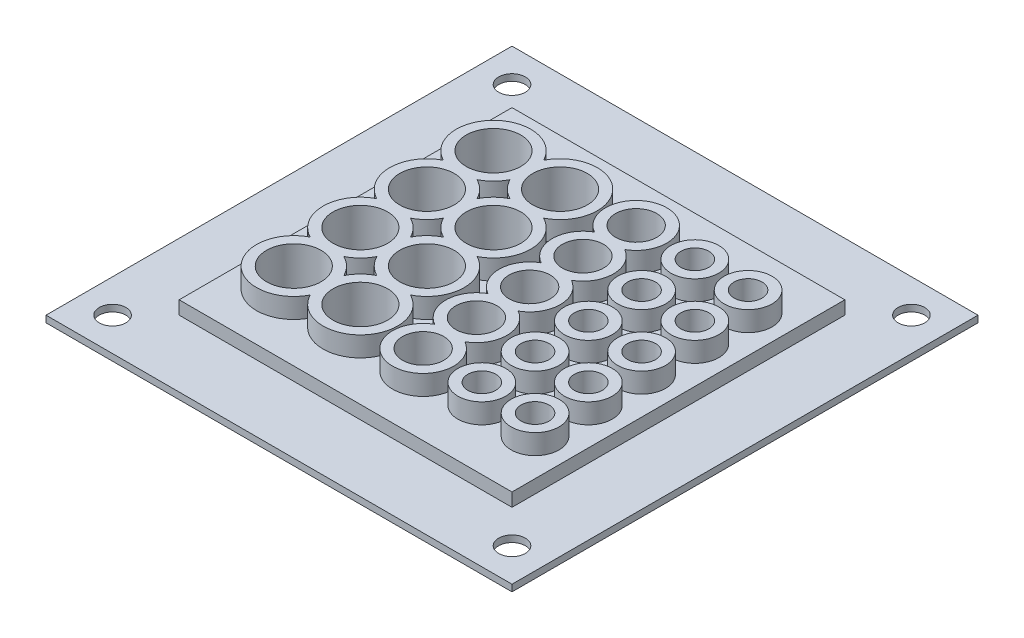
from build123d import *

# Parameters (mm, degrees)
SKETCH1_W           = 50
SKETCH1_H           = 50
SKETCH1_R           = 4.1
SKETCH1_R_2         = 3.1
SKETCH1_R_3         = 2.1
BOSS_EXTRUDE1_DEPTH = 1.5
SKETCH2_R           = 5.6
SKETCH2_R_2         = 4.1
SKETCH2_R_3         = 4.6
SKETCH2_R_4         = 3.1
SKETCH2_R_5         = 3.6
SKETCH2_R_6         = 2.1
EXTRUDE_THIN1_DEPTH = 3
SKETCH3_W           = 70
SKETCH3_H           = 70
SKETCH3_R           = 2
SKETCH3_W_2         = 50
SKETCH3_H_2         = 50
BOSS_EXTRUDE2_DEPTH = 1


with BuildPart() as part:
    # Sketch1 → Boss-Extrude1 (new, symmetric)
    with BuildSketch(Plane(origin=(0, 0, 0), x_dir=(1, 0, 0), z_dir=(0, 1, 0))):
        with Locations((0, 25)):
            Rectangle(SKETCH1_W, SKETCH1_H)
        with Locations(Location((-17.77819266, 10, 0), (0, 0, 270))):
            Circle(SKETCH1_R, mode=Mode.SUBTRACT)
        with Locations(Location((-17.77819266, 20, 0), (0, 0, 270))):
            Circle(SKETCH1_R, mode=Mode.SUBTRACT)
        with Locations(Location((-17.77819266, 30, 0), (0, 0, 270))):
            Circle(SKETCH1_R, mode=Mode.SUBTRACT)
        with Locations(Location((-17.77819266, 40, 0), (0, 0, 270))):
            Circle(SKETCH1_R, mode=Mode.SUBTRACT)
        with Locations(Location((2.654804044, 9, 0), (0, 0, 270))):
            Circle(SKETCH1_R_2, mode=Mode.SUBTRACT)
        with Locations(Location((2.654804044, 17, 0), (0, 0, 270))):
            Circle(SKETCH1_R_2, mode=Mode.SUBTRACT)
        with Locations(Location((2.654804044, 25, 0), (0, 0, 270))):
            Circle(SKETCH1_R_2, mode=Mode.SUBTRACT)
        with Locations(Location((2.654804044, 33, 0), (0, 0, 270))):
            Circle(SKETCH1_R_2, mode=Mode.SUBTRACT)
        with Locations(Location((2.654804044, 41, 0), (0, 0, 270))):
            Circle(SKETCH1_R_2, mode=Mode.SUBTRACT)
        with Locations(Location((11.466739275, 9, 0), (0, 0, 270))):
            Circle(SKETCH1_R_3, mode=Mode.SUBTRACT)
        with Locations(Location((19.466739275, 9, 0), (0, 0, 270))):
            Circle(SKETCH1_R_3, mode=Mode.SUBTRACT)
        with Locations(Location((19.466739275, 17, 0), (0, 0, 270))):
            Circle(SKETCH1_R_3, mode=Mode.SUBTRACT)
        with Locations(Location((19.466739275, 25, 0), (0, 0, 270))):
            Circle(SKETCH1_R_3, mode=Mode.SUBTRACT)
        with Locations(Location((19.466739275, 33, 0), (0, 0, 270))):
            Circle(SKETCH1_R_3, mode=Mode.SUBTRACT)
        with Locations(Location((19.466739275, 41, 0), (0, 0, 270))):
            Circle(SKETCH1_R_3, mode=Mode.SUBTRACT)
        with Locations(Location((11.466739275, 17, 0), (0, 0, 270))):
            Circle(SKETCH1_R_3, mode=Mode.SUBTRACT)
        with Locations(Location((11.466739275, 25, 0), (0, 0, 270))):
            Circle(SKETCH1_R_3, mode=Mode.SUBTRACT)
        with Locations(Location((11.466739275, 33, 0), (0, 0, 270))):
            Circle(SKETCH1_R_3, mode=Mode.SUBTRACT)
        with Locations(Location((11.466739275, 41, 0), (0, 0, 270))):
            Circle(SKETCH1_R_3, mode=Mode.SUBTRACT)
        with Locations(Location((-7.77819266, 10, 0), (0, 0, 270))):
            Circle(SKETCH1_R, mode=Mode.SUBTRACT)
        with Locations(Location((-7.77819266, 20, 0), (0, 0, 270))):
            Circle(SKETCH1_R, mode=Mode.SUBTRACT)
        with Locations(Location((-7.77819266, 30, 0), (0, 0, 270))):
            Circle(SKETCH1_R, mode=Mode.SUBTRACT)
        with Locations(Location((-7.77819266, 40, 0), (0, 0, 270))):
            Circle(SKETCH1_R, mode=Mode.SUBTRACT)
    extrude(amount=BOSS_EXTRUDE1_DEPTH, both=True)

    # Sketch2 → Extrude-Thin1 (add)
    # profile 1 of 23: a face of its own
    with BuildSketch(Plane(origin=(0, 1.5, 0), x_dir=(1, 0, 0), z_dir=(0, 1, 0))):
        with Locations((-17.77819266, 10)):
            Circle(SKETCH2_R)
        with Locations((-17.77819266, 10)):
            Circle(SKETCH2_R_2, mode=Mode.SUBTRACT)
    # profile 2 of 23: a face of its own
    with BuildSketch(Plane(origin=(0, 1.5, 0), x_dir=(1, 0, 0), z_dir=(0, 1, 0))):
        with Locations((-17.77819266, 20)):
            Circle(SKETCH2_R)
        with Locations((-17.77819266, 20)):
            Circle(SKETCH2_R_2, mode=Mode.SUBTRACT)
    # profile 3 of 23: a face of its own
    with BuildSketch(Plane(origin=(0, 1.5, 0), x_dir=(1, 0, 0), z_dir=(0, 1, 0))):
        with Locations((-17.77819266, 30)):
            Circle(SKETCH2_R)
        with Locations((-17.77819266, 30)):
            Circle(SKETCH2_R_2, mode=Mode.SUBTRACT)
    # profile 4 of 23: a face of its own
    with BuildSketch(Plane(origin=(0, 1.5, 0), x_dir=(1, 0, 0), z_dir=(0, 1, 0))):
        with Locations((2.654804044, 17)):
            Circle(SKETCH2_R_3)
        with Locations((2.654804044, 17)):
            Circle(SKETCH2_R_4, mode=Mode.SUBTRACT)
    # profile 5 of 23: a face of its own
    with BuildSketch(Plane(origin=(0, 1.5, 0), x_dir=(1, 0, 0), z_dir=(0, 1, 0))):
        with Locations((-17.77819266, 40)):
            Circle(SKETCH2_R)
        with Locations((-17.77819266, 40)):
            Circle(SKETCH2_R_2, mode=Mode.SUBTRACT)
    # profile 6 of 23: a face of its own
    with BuildSketch(Plane(origin=(0, 1.5, 0), x_dir=(1, 0, 0), z_dir=(0, 1, 0))):
        with Locations((2.654804044, 9)):
            Circle(SKETCH2_R_3)
        with Locations((2.654804044, 9)):
            Circle(SKETCH2_R_4, mode=Mode.SUBTRACT)
    # profile 7 of 23: a face of its own
    with BuildSketch(Plane(origin=(0, 1.5, 0), x_dir=(1, 0, 0), z_dir=(0, 1, 0))):
        with Locations((2.654804044, 25)):
            Circle(SKETCH2_R_3)
        with Locations((2.654804044, 25)):
            Circle(SKETCH2_R_4, mode=Mode.SUBTRACT)
    # profile 8 of 23: a face of its own
    with BuildSketch(Plane(origin=(0, 1.5, 0), x_dir=(1, 0, 0), z_dir=(0, 1, 0))):
        with Locations((2.654804044, 33)):
            Circle(SKETCH2_R_3)
        with Locations((2.654804044, 33)):
            Circle(SKETCH2_R_4, mode=Mode.SUBTRACT)
    # profile 9 of 23: a face of its own
    with BuildSketch(Plane(origin=(0, 1.5, 0), x_dir=(1, 0, 0), z_dir=(0, 1, 0))):
        with Locations((2.654804044, 41)):
            Circle(SKETCH2_R_3)
        with Locations((2.654804044, 41)):
            Circle(SKETCH2_R_4, mode=Mode.SUBTRACT)
    # profile 10 of 23: a face of its own
    with BuildSketch(Plane(origin=(0, 1.5, 0), x_dir=(1, 0, 0), z_dir=(0, 1, 0))):
        with Locations((11.466739275, 9)):
            Circle(SKETCH2_R_5)
        with Locations((11.466739275, 9)):
            Circle(SKETCH2_R_6, mode=Mode.SUBTRACT)
    # profile 11 of 23: a face of its own
    with BuildSketch(Plane(origin=(0, 1.5, 0), x_dir=(1, 0, 0), z_dir=(0, 1, 0))):
        with Locations((-7.77819266, 10)):
            Circle(SKETCH2_R)
        with Locations((-7.77819266, 10)):
            Circle(SKETCH2_R_2, mode=Mode.SUBTRACT)
    # profile 12 of 23: a face of its own
    with BuildSketch(Plane(origin=(0, 1.5, 0), x_dir=(1, 0, 0), z_dir=(0, 1, 0))):
        with Locations((19.466739275, 9)):
            Circle(SKETCH2_R_5)
        with Locations((19.466739275, 9)):
            Circle(SKETCH2_R_6, mode=Mode.SUBTRACT)
    # profile 13 of 23: a face of its own
    with BuildSketch(Plane(origin=(0, 1.5, 0), x_dir=(1, 0, 0), z_dir=(0, 1, 0))):
        with Locations((19.466739275, 17)):
            Circle(SKETCH2_R_5)
        with Locations((19.466739275, 17)):
            Circle(SKETCH2_R_6, mode=Mode.SUBTRACT)
    # profile 14 of 23: a face of its own
    with BuildSketch(Plane(origin=(0, 1.5, 0), x_dir=(1, 0, 0), z_dir=(0, 1, 0))):
        with Locations((19.466739275, 25)):
            Circle(SKETCH2_R_5)
        with Locations((19.466739275, 25)):
            Circle(SKETCH2_R_6, mode=Mode.SUBTRACT)
    # profile 15 of 23: a face of its own
    with BuildSketch(Plane(origin=(0, 1.5, 0), x_dir=(1, 0, 0), z_dir=(0, 1, 0))):
        with Locations((19.466739275, 33)):
            Circle(SKETCH2_R_5)
        with Locations((19.466739275, 33)):
            Circle(SKETCH2_R_6, mode=Mode.SUBTRACT)
    # profile 16 of 23: a face of its own
    with BuildSketch(Plane(origin=(0, 1.5, 0), x_dir=(1, 0, 0), z_dir=(0, 1, 0))):
        with Locations((19.466739275, 41)):
            Circle(SKETCH2_R_5)
        with Locations((19.466739275, 41)):
            Circle(SKETCH2_R_6, mode=Mode.SUBTRACT)
    # profile 17 of 23: a face of its own
    with BuildSketch(Plane(origin=(0, 1.5, 0), x_dir=(1, 0, 0), z_dir=(0, 1, 0))):
        with Locations((11.466739275, 17)):
            Circle(SKETCH2_R_5)
        with Locations((11.466739275, 17)):
            Circle(SKETCH2_R_6, mode=Mode.SUBTRACT)
    # profile 18 of 23: a face of its own
    with BuildSketch(Plane(origin=(0, 1.5, 0), x_dir=(1, 0, 0), z_dir=(0, 1, 0))):
        with Locations((11.466739275, 25)):
            Circle(SKETCH2_R_5)
        with Locations((11.466739275, 25)):
            Circle(SKETCH2_R_6, mode=Mode.SUBTRACT)
    # profile 19 of 23: a face of its own
    with BuildSketch(Plane(origin=(0, 1.5, 0), x_dir=(1, 0, 0), z_dir=(0, 1, 0))):
        with Locations((11.466739275, 33)):
            Circle(SKETCH2_R_5)
        with Locations((11.466739275, 33)):
            Circle(SKETCH2_R_6, mode=Mode.SUBTRACT)
    # profile 20 of 23: a face of its own
    with BuildSketch(Plane(origin=(0, 1.5, 0), x_dir=(1, 0, 0), z_dir=(0, 1, 0))):
        with Locations((11.466739275, 41)):
            Circle(SKETCH2_R_5)
        with Locations((11.466739275, 41)):
            Circle(SKETCH2_R_6, mode=Mode.SUBTRACT)
    # profile 21 of 23: a face of its own
    with BuildSketch(Plane(origin=(0, 1.5, 0), x_dir=(1, 0, 0), z_dir=(0, 1, 0))):
        with Locations((-7.77819266, 20)):
            Circle(SKETCH2_R)
        with Locations((-7.77819266, 20)):
            Circle(SKETCH2_R_2, mode=Mode.SUBTRACT)
    # profile 22 of 23: a face of its own
    with BuildSketch(Plane(origin=(0, 1.5, 0), x_dir=(1, 0, 0), z_dir=(0, 1, 0))):
        with Locations((-7.77819266, 30)):
            Circle(SKETCH2_R)
        with Locations((-7.77819266, 30)):
            Circle(SKETCH2_R_2, mode=Mode.SUBTRACT)
    # profile 23 of 23: a face of its own
    with BuildSketch(Plane(origin=(0, 1.5, 0), x_dir=(1, 0, 0), z_dir=(0, 1, 0))):
        with Locations((-7.77819266, 40)):
            Circle(SKETCH2_R)
        with Locations((-7.77819266, 40)):
            Circle(SKETCH2_R_2, mode=Mode.SUBTRACT)
    extrude(amount=EXTRUDE_THIN1_DEPTH)

    # Sketch3 → Boss-Extrude2 (add)
    with BuildSketch(Plane.XZ.offset(1.5)):
        with Locations((0, -25)):
            Rectangle(SKETCH3_W, SKETCH3_H)
        with Locations(Location((-30, 5, 0), (0, 0, 270))):
            Circle(SKETCH3_R, mode=Mode.SUBTRACT)
        with Locations(Location((30, 5, 0), (0, 0, 270))):
            Circle(SKETCH3_R, mode=Mode.SUBTRACT)
        with Locations(Location((30, -55, 0), (0, 0, 270))):
            Circle(SKETCH3_R, mode=Mode.SUBTRACT)
        with Locations(Location((-30, -55, 0), (0, 0, 270))):
            Circle(SKETCH3_R, mode=Mode.SUBTRACT)
        with Locations((0, -25)):
            Rectangle(SKETCH3_W_2, SKETCH3_H_2, mode=Mode.SUBTRACT)
    extrude(amount=-BOSS_EXTRUDE2_DEPTH)


solid = part.part
